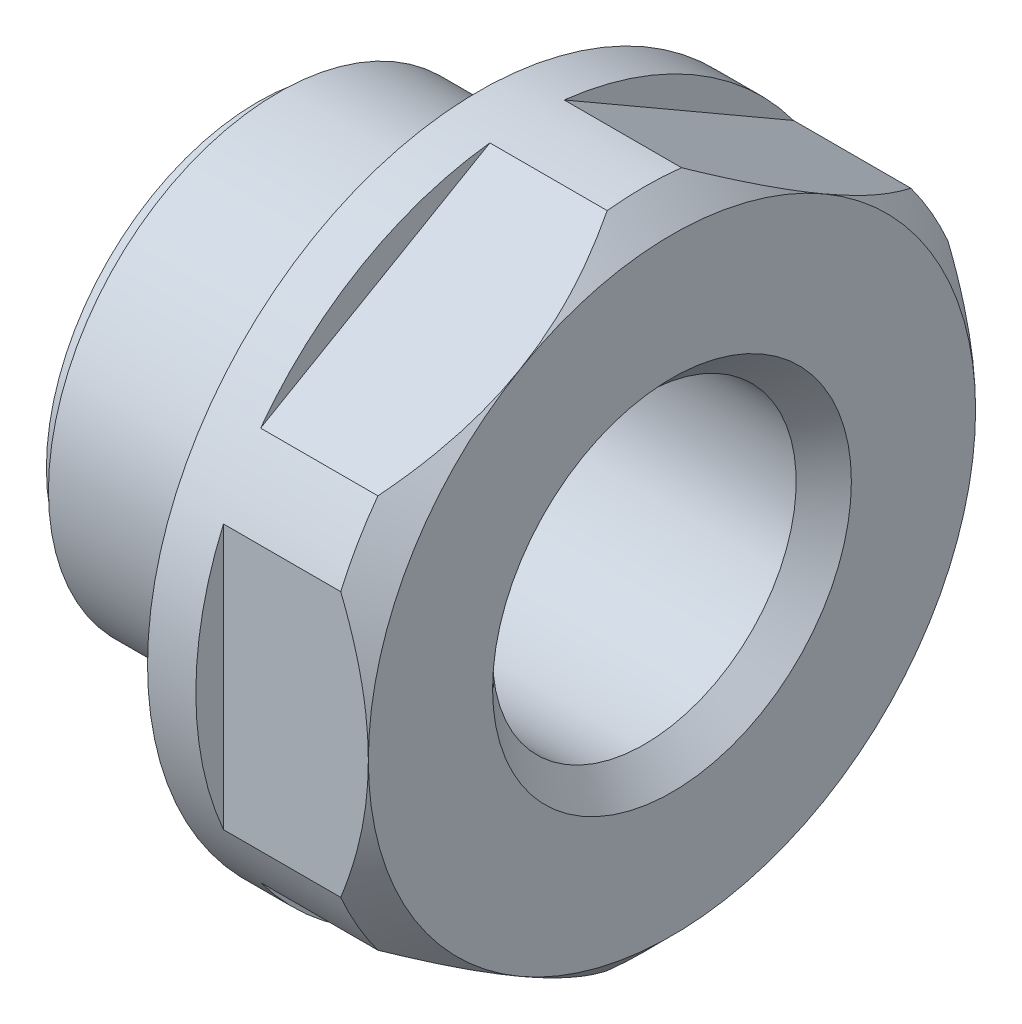
from build123d import *

# Parameters (mm, degrees)
TAGLIO_ESTRUSIONE1_DEPTH      = 5.25
TAGLIO_ESTRUSIONE1_DEPTH_BACK = 5.25
TAGLIO_ESTRUSIONE2_DEPTH      = 5.25
TAGLIO_ESTRUSIONE2_DEPTH_BACK = 5.25


with BuildPart() as part:
    # Schizzo1 → Rivoluzione1 (revolve)
    with BuildSketch(Plane.XY):
        Polygon((0, 6.5), (6.153846154, 6.5), (6.153846154, 5.5), (14, 5.5), (15, 6.5), (15, 11), (14, 12), (8, 12), (8, 8.33), (0.740444444, 8.33), (0.740444444, 7.6636), (0, 7.6636), align=None)
    revolve(axis=Axis((15, 0, 0), (-1, 0, 0)))

    # Schizzo2 → Taglio-Estrusione1 (cut, two sides: drawn at the far end of the back side and taken through both)
    with BuildSketch(Plane(origin=(15, 0, 0), x_dir=(0, 0, -1), z_dir=(1, 0, 0)).offset(-TAGLIO_ESTRUSIONE1_DEPTH_BACK)):
        Polygon((-16.5, -9.526279442), (1, -19.629909152), (1, -13.279056191), (-11, -6.350852961), (-11, 6.350852961), (1, 13.279056191), (1, 19.629909152), (-16.5, 9.526279442), align=None)
    extrude(amount=TAGLIO_ESTRUSIONE1_DEPTH + TAGLIO_ESTRUSIONE1_DEPTH_BACK, mode=Mode.SUBTRACT)

    # Schizzo3 → Taglio-Estrusione2 (cut, two sides: drawn at the far end of the back side and taken through both)
    with BuildSketch(Plane(origin=(15, 0, 0), x_dir=(0, 0, -1), z_dir=(1, 0, 0)).offset(-TAGLIO_ESTRUSIONE2_DEPTH_BACK)):
        Polygon((-1, -19.629909152), (16.5, -9.526279442), (16.5, 9.526279442), (-1, 19.629909152), (-1, 13.279056191), (11, 6.350852961), (11, -6.350852961), (-1, -13.279056191), align=None)
    extrude(amount=TAGLIO_ESTRUSIONE2_DEPTH + TAGLIO_ESTRUSIONE2_DEPTH_BACK, mode=Mode.SUBTRACT)


solid = part.part
